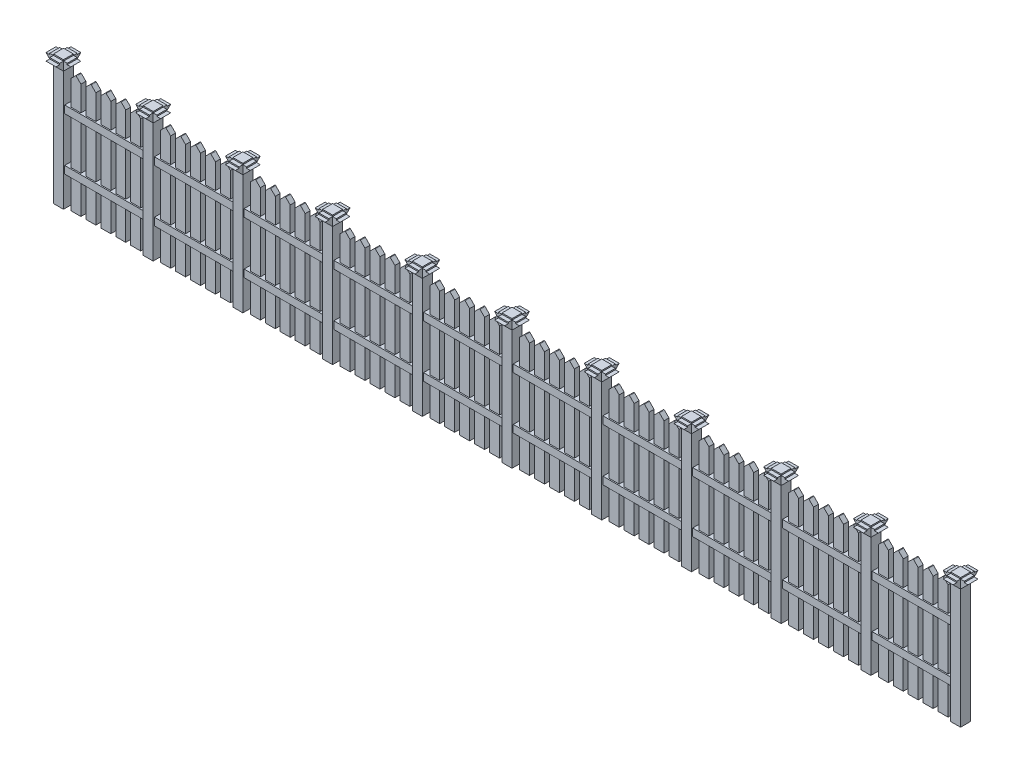
from build123d import *

# Parameters (mm, degrees)
SKETCH1_W           = 101.6
SKETCH1_H           = 101.6
BOSS_EXTRUDE1_DEPTH = 1219.2
BOSS_EXTRUDE2_DEPTH = 101.6
BOSS_EXTRUDE3_DEPTH = 101.6
SKETCH4_W           = 101.6
SKETCH4_H           = 1219.2
BOSS_EXTRUDE4_DEPTH = 25.4
CUT_EXTRUDE2_DEPTH  = 50.8
CUT_EXTRUDE3_DEPTH  = 50.8
CUT_EXTRUDE4_DEPTH  = 50.8
SKETCH8_W           = 76.2
SKETCH8_H           = 76.2
BOSS_EXTRUDE7_DEPTH = 812.8
SKETCH9_W           = 76.2
SKETCH9_H           = 76.2
BOSS_EXTRUDE8_DEPTH = 812.8
LPATTERN25_COUNT    = 5
LPATTERN25_PITCH    = 152.4
LPATTERN30_COUNT    = 11
LPATTERN30_PITCH    = 914.4


with BuildPart() as part:
    # Sketch1 → Boss-Extrude1 (new body)
    with BuildSketch(Plane(origin=(0, 0, 0), x_dir=(1, 0, 0), z_dir=(0, 1, 0))):
        with Locations((50.8, 50.8)):
            Rectangle(SKETCH1_W, SKETCH1_H)
    extrude(amount=BOSS_EXTRUDE1_DEPTH)

    # Sketch2 → Boss-Extrude2 (add)
    with BuildSketch(Plane.XY):
        Polygon((101.6, 1219.2), (177.8, 1295.4), (139.7, 1295.4), (139.7, 1308.1), (101.6, 1308.1), (101.6, 1320.8), (0, 1320.8), (0, 1308.1), (-38.1, 1308.1), (-38.1, 1295.4), (-76.2, 1295.4), (0, 1219.2), align=None)
    extrude(amount=-BOSS_EXTRUDE2_DEPTH)

    # Sketch3 → Boss-Extrude3 (add)
    with BuildSketch(Plane(origin=(0, 0, 0), x_dir=(0, 0, -1), z_dir=(1, 0, 0))):
        Polygon((0, 1219.2), (-76.2, 1295.4), (-38.1, 1295.4), (-38.1, 1308.1), (0, 1308.1), align=None)
    boss_extrude3 = extrude(amount=BOSS_EXTRUDE3_DEPTH)

    # Mirror1: Boss-Extrude3 across plane
    add(boss_extrude3.mirror(Plane.XY.offset(-50.8)))


with BuildPart() as body_2:
    # Sketch4 → Boss-Extrude4 (new, symmetric)
    with BuildSketch(Plane.XY.offset(-50.8)):
        with Locations((203.2, 609.6)):
            Rectangle(SKETCH4_W, SKETCH4_H)
    extrude(amount=BOSS_EXTRUDE4_DEPTH, both=True)

    # Sketch5 → Cut-Extrude2 (cut)
    with BuildSketch(Plane.XY.offset(-25.4)):
        Polygon((203.2, 1219.2), (152.4, 1168.4), (152.4, 1219.2), align=None)
    extrude(amount=-CUT_EXTRUDE2_DEPTH, mode=Mode.SUBTRACT)

    # Sketch6 → Cut-Extrude3 (cut)
    with BuildSketch(Plane.XY.offset(-25.4)):
        Polygon((203.2, 1219.2), (254, 1168.4), (254, 1219.2), align=None)
    extrude(amount=-CUT_EXTRUDE3_DEPTH, mode=Mode.SUBTRACT)

    # Sketch7 → Cut-Extrude4 (cut)
    with BuildSketch(Plane.XY.offset(-25.4)):
        with BuildLine():
            Line((203.2, 1219.2), (207.690128061, 1214.709871939))
            ThreePointArc((207.690128061, 1214.709871939), (203.2, 1216.569743879), (198.709871939, 1214.709871939))
            Line((198.709871939, 1214.709871939), (203.2, 1219.2))
        make_face()
    extrude(amount=-CUT_EXTRUDE4_DEPTH, mode=Mode.SUBTRACT)


with BuildPart() as body_3:
    # Sketch8 → Boss-Extrude7 (new body)
    with BuildSketch(Plane(origin=(101.6, 0, 0), x_dir=(0, 0, -1), z_dir=(1, 0, 0))):
        with Locations((50.8, 342.9)):
            Rectangle(SKETCH8_W, SKETCH8_H)
    extrude(amount=BOSS_EXTRUDE7_DEPTH)


with BuildPart() as body_4:
    # Sketch9 → Boss-Extrude8 (new body)
    with BuildSketch(Plane(origin=(101.6, 0, 0), x_dir=(0, 0, -1), z_dir=(1, 0, 0))):
        with Locations((50.8, 876.3)):
            Rectangle(SKETCH9_W, SKETCH9_H)
    extrude(amount=BOSS_EXTRUDE8_DEPTH)


with BuildPart() as lpattern25_1:
    # LPattern25: pattern copy
    add(body_2.part.moved(Location(Vector(1, 0, 0) * (1 * LPATTERN25_PITCH))))


with BuildPart() as lpattern25_2:
    # LPattern25: pattern copy
    add(body_2.part.moved(Location(Vector(1, 0, 0) * (2 * LPATTERN25_PITCH))))


with BuildPart() as lpattern25_3:
    # LPattern25: pattern copy
    add(body_2.part.moved(Location(Vector(1, 0, 0) * (3 * LPATTERN25_PITCH))))


with BuildPart() as lpattern25_4:
    # LPattern25: pattern copy
    add(body_2.part.moved(Location(Vector(1, 0, 0) * (4 * LPATTERN25_PITCH))))


with BuildPart() as body_2_1:
    add(body_2.part)

    # Combine1: union body 3, body 4, LPattern25_1, LPattern25_2, LPattern25_3, LPattern25_4
    add(body_3.part)
    add(body_4.part)
    add(lpattern25_1.part)
    add(lpattern25_2.part)
    add(lpattern25_3.part)
    add(lpattern25_4.part)


with BuildPart() as lpattern30_1:
    # LPattern30: pattern copy
    add(body_2_1.part.moved(Location(Vector(1, 0, 0) * (1 * LPATTERN30_PITCH))))


with BuildPart() as lpattern30_2:
    # LPattern30: pattern copy
    add(body_2_1.part.moved(Location(Vector(1, 0, 0) * (2 * LPATTERN30_PITCH))))


with BuildPart() as lpattern30_3:
    # LPattern30: pattern copy
    add(body_2_1.part.moved(Location(Vector(1, 0, 0) * (3 * LPATTERN30_PITCH))))


with BuildPart() as lpattern30_4:
    # LPattern30: pattern copy
    add(body_2_1.part.moved(Location(Vector(1, 0, 0) * (4 * LPATTERN30_PITCH))))


with BuildPart() as lpattern30_5:
    # LPattern30: pattern copy
    add(body_2_1.part.moved(Location(Vector(1, 0, 0) * (5 * LPATTERN30_PITCH))))


with BuildPart() as lpattern30_6:
    # LPattern30: pattern copy
    add(body_2_1.part.moved(Location(Vector(1, 0, 0) * (6 * LPATTERN30_PITCH))))


with BuildPart() as lpattern30_7:
    # LPattern30: pattern copy
    add(body_2_1.part.moved(Location(Vector(1, 0, 0) * (7 * LPATTERN30_PITCH))))


with BuildPart() as lpattern30_8:
    # LPattern30: pattern copy
    add(body_2_1.part.moved(Location(Vector(1, 0, 0) * (8 * LPATTERN30_PITCH))))


with BuildPart() as lpattern30_9:
    # LPattern30: pattern copy
    add(body_2_1.part.moved(Location(Vector(1, 0, 0) * (9 * LPATTERN30_PITCH))))


with BuildPart() as lpattern30_10:
    # LPattern30: pattern copy
    add(body_2_1.part.moved(Location(Vector(1, 0, 0) * (10 * LPATTERN30_PITCH))))


with BuildPart() as lpattern30_11:
    # LPattern30: pattern copy
    add(part.part.moved(Location(Vector(1, 0, 0) * (1 * LPATTERN30_PITCH))))


with BuildPart() as lpattern30_12:
    # LPattern30: pattern copy
    add(part.part.moved(Location(Vector(1, 0, 0) * (2 * LPATTERN30_PITCH))))


with BuildPart() as lpattern30_13:
    # LPattern30: pattern copy
    add(part.part.moved(Location(Vector(1, 0, 0) * (3 * LPATTERN30_PITCH))))


with BuildPart() as lpattern30_14:
    # LPattern30: pattern copy
    add(part.part.moved(Location(Vector(1, 0, 0) * (4 * LPATTERN30_PITCH))))


with BuildPart() as lpattern30_15:
    # LPattern30: pattern copy
    add(part.part.moved(Location(Vector(1, 0, 0) * (5 * LPATTERN30_PITCH))))


with BuildPart() as lpattern30_16:
    # LPattern30: pattern copy
    add(part.part.moved(Location(Vector(1, 0, 0) * (6 * LPATTERN30_PITCH))))


with BuildPart() as lpattern30_17:
    # LPattern30: pattern copy
    add(part.part.moved(Location(Vector(1, 0, 0) * (7 * LPATTERN30_PITCH))))


with BuildPart() as lpattern30_18:
    # LPattern30: pattern copy
    add(part.part.moved(Location(Vector(1, 0, 0) * (8 * LPATTERN30_PITCH))))


with BuildPart() as lpattern30_19:
    # LPattern30: pattern copy
    add(part.part.moved(Location(Vector(1, 0, 0) * (9 * LPATTERN30_PITCH))))


with BuildPart() as lpattern30_20:
    # LPattern30: pattern copy
    add(part.part.moved(Location(Vector(1, 0, 0) * (10 * LPATTERN30_PITCH))))


solid = Compound([part.part, body_2_1.part, lpattern30_1.part, lpattern30_2.part, lpattern30_3.part, lpattern30_4.part, lpattern30_5.part, lpattern30_6.part, lpattern30_7.part, lpattern30_8.part, lpattern30_9.part, lpattern30_11.part, lpattern30_12.part, lpattern30_13.part, lpattern30_14.part, lpattern30_15.part, lpattern30_16.part, lpattern30_17.part, lpattern30_18.part, lpattern30_19.part, lpattern30_20.part])
